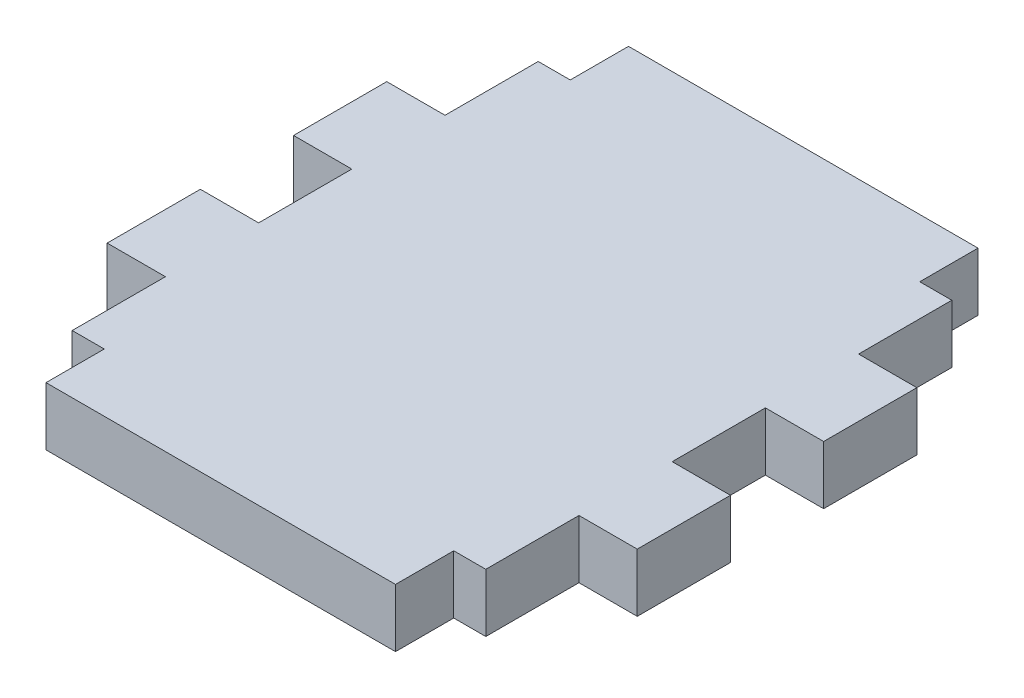
from build123d import *

# Parameters (mm, degrees)
RESSALTO_EXTRUS_O1_DEPTH = 3


with BuildPart() as part:
    # Esboço1 → Ressalto-extrusão1 (new body)
    with BuildSketch(Plane(origin=(0, 0, 0), x_dir=(1, 0, 0), z_dir=(0, 1, 0))):
        Polygon((-56.400735041, 6.460529511), (-56.400735041, 9.460529511), (-38.400735041, 9.460529511), (-38.400735041, 6.460529511), (-36.750735041, 6.460529511), (-36.750735041, 1.660529511), (-33.750735041, 1.660529511), (-33.750735041, -3.139470489), (-36.750735041, -3.139470489), (-36.750735041, -7.939470489), (-33.750735041, -7.939470489), (-33.750735041, -12.739470489), (-36.750735041, -12.739470489), (-36.750735041, -17.539470489), (-38.400735041, -17.539470489), (-38.400735041, -20.539470489), (-56.400735041, -20.539470489), (-56.400735041, -17.539470489), (-58.050735041, -17.539470489), (-58.050735041, -12.739470489), (-61.050735041, -12.739470489), (-61.050735041, -7.939470489), (-58.050735041, -7.939470489), (-58.050735041, -3.139470489), (-61.050735041, -3.139470489), (-61.050735041, 1.660529511), (-58.050735041, 1.660529511), (-58.050735041, 6.460529511), align=None)
    extrude(amount=RESSALTO_EXTRUS_O1_DEPTH)


solid = part.part
